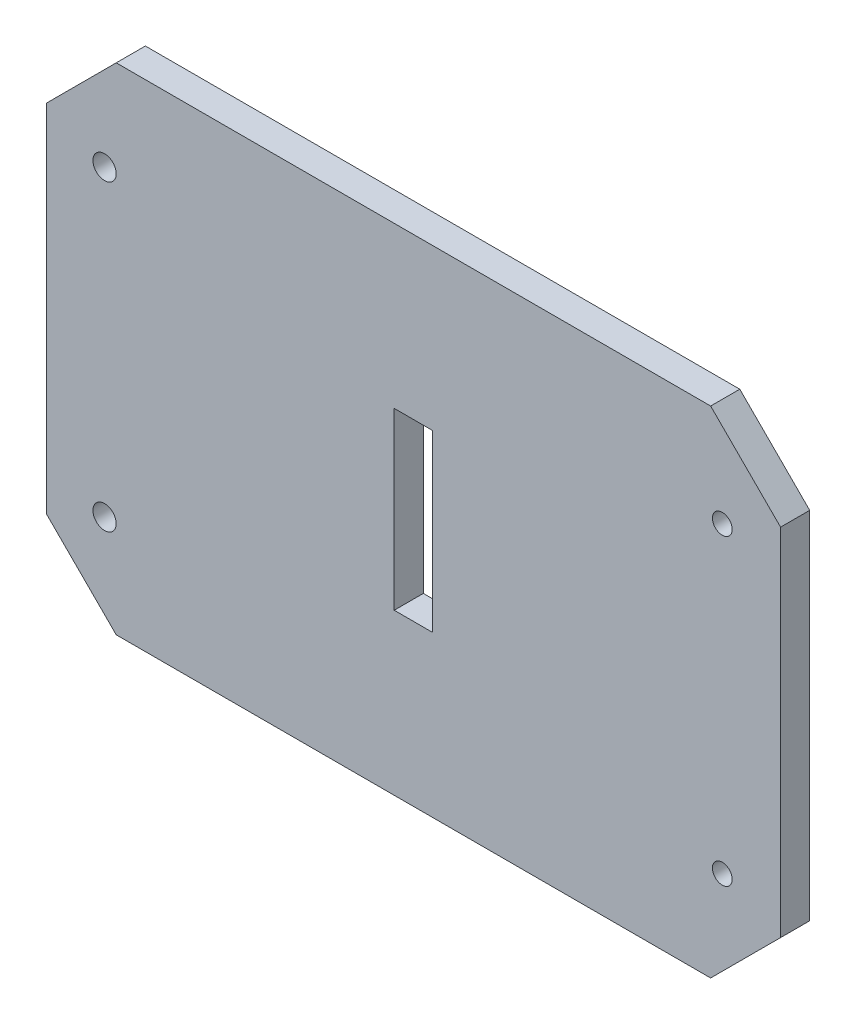
from build123d import *

# Parameters (mm, degrees)
SKETCH_1_R                  = 2
SKETCH_1_R_2                = 1.7
SKETCH_1_W                  = 6.6
SKETCH_1_H                  = 30
F_09_C920_TRIPOD_TRAY_DEPTH = 5


with BuildPart() as part:
    # Эскиз1 → 09_C920_tripod_tray (new body)
    with BuildSketch(Plane.XY):
        Polygon((-51, -42.5), (51, -42.5), (63, -30.5), (63, 30.5), (51, 42.5), (-51, 42.5), (-63, 30.5), (-63, -30.5), align=None)
        with Locations((-53, -26)):
            Circle(SKETCH_1_R, mode=Mode.SUBTRACT)
        with Locations((-53, 26)):
            Circle(SKETCH_1_R, mode=Mode.SUBTRACT)
        with Locations((53, -26)):
            Circle(SKETCH_1_R_2, mode=Mode.SUBTRACT)
        with Locations((53, 26)):
            Circle(SKETCH_1_R_2, mode=Mode.SUBTRACT)
        Rectangle(SKETCH_1_W, SKETCH_1_H, mode=Mode.SUBTRACT)
    extrude(amount=F_09_C920_TRIPOD_TRAY_DEPTH)


solid = part.part
